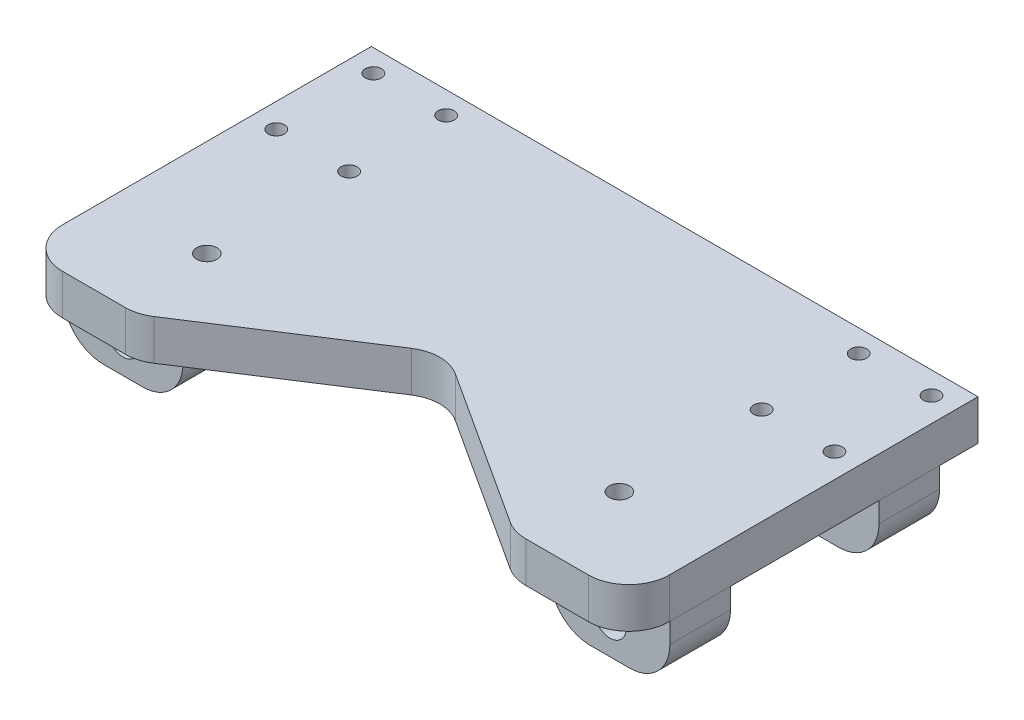
from build123d import *

# Parameters (mm, degrees)
SKETCH3_R               = 2
SKETCH3_R_2             = 2.5
BOSS_EXTRUDE3_DEPTH     = 10
SKETCH4_W               = 29.621982307
SKETCH4_H               = 15
SKETCH4_W_2             = 29.629902686
BOSS_EXTRUDE4_DEPTH     = 15
FILLET1_R               = 10
CUT_EXTRUDE1_DEPTH      = 57
CUT_EXTRUDE1_DEPTH_BACK = 15
SKETCH5_R               = 4
FILLET3_R               = 10


with BuildPart() as part:
    # Sketch3 → Boss-Extrude3 (new body)
    with BuildSketch(Plane(origin=(0, 0, 0), x_dir=(1, 0, 0), z_dir=(0, 1, 0))):
        with BuildLine():
            Line((-74.553080605, -18.028525235), (-74.553080605, 16.971474765))
            Line((-74.553080605, 16.971474765), (75.446919395, 16.971474765))
            Line((75.446919395, 16.971474765), (75.446919395, -18.028525235))
            Line((75.446919395, -18.028525235), (75.446919395, -59.351917417))
            ThreePointArc((75.446919395, -59.351917417), (72.517987207, -66.422985229), (65.446919395, -69.351917417))
            Line((65.446919395, -69.351917417), (49.960719272, -69.351917417))
            ThreePointArc((49.960719272, -69.351917417), (47.125982353, -68.941717551), (44.523807175, -67.744770737))
            Line((44.523807175, -67.744770737), (5.883831491, -42.713694512))
            ThreePointArc((5.883831491, -42.713694512), (0.446919395, -41.106547832), (-4.989992702, -42.713694512))
            Line((-4.989992702, -42.713694512), (-43.629968386, -67.744770737))
            ThreePointArc((-43.629968386, -67.744770737), (-46.232143563, -68.941717551), (-49.066880482, -69.351917417))
            Line((-49.066880482, -69.351917417), (-64.553080605, -69.351917417))
            ThreePointArc((-64.553080605, -69.351917417), (-71.624148417, -66.422985229), (-74.553080605, -59.351917417))
            Line((-74.553080605, -59.351917417), (-74.553080605, -18.028525235))
        make_face()
        with Locations(Location((-68.553080605, 11.471474765, 0), (0, 0, 270))):
            Circle(SKETCH3_R, mode=Mode.SUBTRACT)
        with Locations(Location((-50.553080605, 11.471474765, 0), (0, 0, 270))):
            Circle(SKETCH3_R, mode=Mode.SUBTRACT)
        with Locations(Location((-68.553080605, -12.528525235, 0), (0, 0, 270))):
            Circle(SKETCH3_R, mode=Mode.SUBTRACT)
        with Locations(Location((-50.553080605, -12.528525235, 0), (0, 0, 270))):
            Circle(SKETCH3_R, mode=Mode.SUBTRACT)
        with Locations(Location((51.446919395, -12.528525235, 0), (0, 0, 90))):
            Circle(SKETCH3_R, mode=Mode.SUBTRACT)
        with Locations(Location((69.446919395, -12.528525235, 0), (0, 0, 90))):
            Circle(SKETCH3_R, mode=Mode.SUBTRACT)
        with Locations(Location((69.446919395, 11.471474765, 0), (0, 0, 90))):
            Circle(SKETCH3_R, mode=Mode.SUBTRACT)
        with Locations(Location((51.446919395, 11.471474765, 0), (0, 0, 90))):
            Circle(SKETCH3_R, mode=Mode.SUBTRACT)
        with Locations(Location((-50.553080605, -47.693315976, 0), (0, 0, 270))):
            Circle(SKETCH3_R_2, mode=Mode.SUBTRACT)
        with Locations(Location((51.446919395, -47.693315976, 0), (0, 0, 90))):
            Circle(SKETCH3_R_2, mode=Mode.SUBTRACT)
    extrude(amount=BOSS_EXTRUDE3_DEPTH)

    # Sketch4 → Boss-Extrude4 (add)
    with BuildSketch(Plane.XZ):
        with Locations((-59.742089452, 0)):
            Rectangle(SKETCH4_W, SKETCH4_H)
        with Locations((60.624047673, 0)):
            Rectangle(SKETCH4_W_2, SKETCH4_H)
        with Locations((60.624047673, 51.713197214)):
            Rectangle(SKETCH4_W_2, SKETCH4_H)
        with Locations((-59.742089452, 51.713197214)):
            Rectangle(SKETCH4_W, SKETCH4_H)
    extrude(amount=BOSS_EXTRUDE4_DEPTH)

    # Fillet1
    fillet1_edges = [part.edges().sort_by_distance(p)[0] for p in [
        (-44.931098298, -15, 0),
        (-74.553080605, -15, 0),
        (75.438999016, -15, 0),
        (45.80909633, -15, 0),
    ]]
    fillet(fillet1_edges, radius=FILLET1_R)

    # Sketch5 → Cut-Extrude1 (cut, two sides: drawn at the far end of the back side and taken through both)
    with BuildSketch(Plane.XY.offset(7.5).offset(-CUT_EXTRUDE1_DEPTH_BACK)):
        with Locations(Location((-59.742089451, -7.004049179, 0), (0, 0, 180))):
            Circle(SKETCH5_R)
        with Locations(Location((60.620087484, -7.004049179, 0), (0, 0, 180))):
            Circle(SKETCH5_R)
    extrude(amount=CUT_EXTRUDE1_DEPTH + CUT_EXTRUDE1_DEPTH_BACK, mode=Mode.SUBTRACT)

    # Fillet3
    fillet3_edges = [part.edges().sort_by_distance(p)[0] for p in [
        (45.80909633, -15, 51.713197214),
        (75.438999016, -15, 51.713197214),
        (-74.553080605, -15, 51.713197214),
        (-44.931098298, -15, 51.713197214),
    ]]
    fillet(fillet3_edges, radius=FILLET3_R)


solid = part.part
